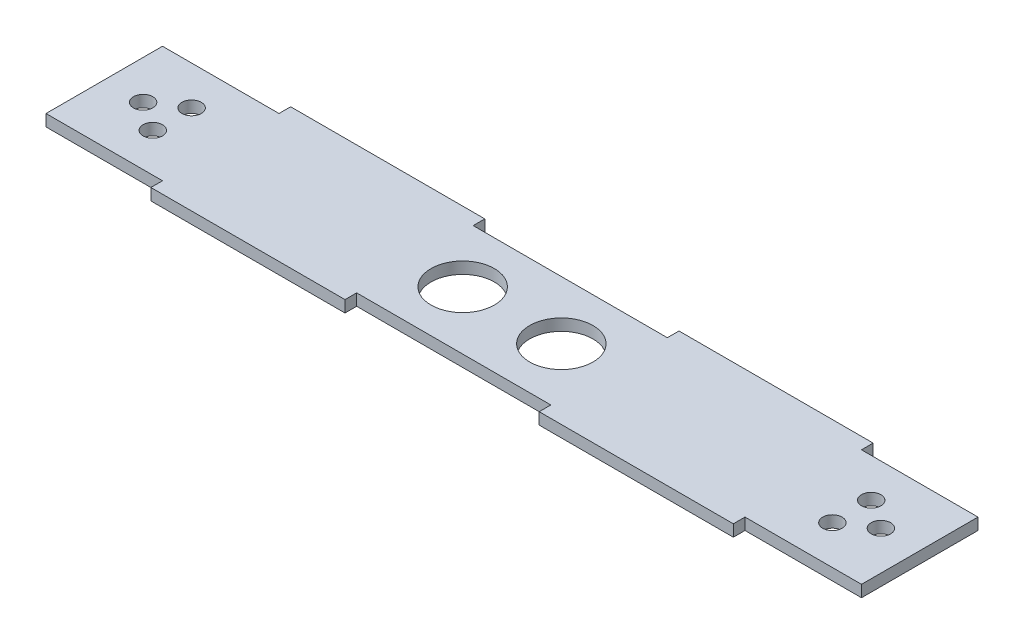
from build123d import *

# Parameters (mm, degrees)
SKETCH1_W           = 210
SKETCH1_H           = 30
BOSS_EXTRUDE1_DEPTH = 3
SKETCH2_W           = 50
SKETCH2_H           = 3
BOSS_EXTRUDE2_DEPTH = 3
SKETCH3_R           = 8.15
CUT_EXTRUDE1_DEPTH  = 10
SKETCH4_R           = 2.5
CUT_EXTRUDE2_DEPTH  = 10


with BuildPart() as part:
    # Sketch1 → Boss-Extrude1 (new body)
    with BuildSketch(Plane(origin=(0, 0, 0), x_dir=(1, 0, 0), z_dir=(0, 1, 0))):
        Rectangle(SKETCH1_W, SKETCH1_H)
    extrude(amount=BOSS_EXTRUDE1_DEPTH)

    # Sketch2 → Boss-Extrude2 (add)
    with BuildSketch(Plane(origin=(0, 0, 0), x_dir=(1, 0, 0), z_dir=(0, 1, 0))):
        with Locations((-50, 16.5)):
            Rectangle(SKETCH2_W, SKETCH2_H)
        with Locations((50, 16.5)):
            Rectangle(SKETCH2_W, SKETCH2_H)
        with Locations((50, -16.5)):
            Rectangle(SKETCH2_W, SKETCH2_H)
        with Locations((-50, -16.5)):
            Rectangle(SKETCH2_W, SKETCH2_H)
    extrude(amount=BOSS_EXTRUDE2_DEPTH)

    # Sketch3 → Cut-Extrude1 (cut)
    with BuildSketch(Plane(origin=(0, 3, 0), x_dir=(1, 0, 0), z_dir=(0, 1, 0))):
        with Locations(Location((-12.7, 0, 0), (0, 0, 270))):
            Circle(SKETCH3_R)
        with Locations(Location((12.7, 0, 0), (0, 0, 90))):
            Circle(SKETCH3_R)
    extrude(amount=-CUT_EXTRUDE1_DEPTH, mode=Mode.SUBTRACT)

    # Sketch4 → Cut-Extrude2 (cut)
    with BuildSketch(Plane(origin=(0, 3, 0), x_dir=(1, 0, 0), z_dir=(0, 1, 0))):
        with Locations(Location((-95, 0, 0), (0, 0, 270))):
            Circle(SKETCH4_R)
        with Locations(Location((-87.5, 5, 0), (0, 0, 270))):
            Circle(SKETCH4_R)
        with Locations(Location((-87.5, -5, 0), (0, 0, 270))):
            Circle(SKETCH4_R)
        with Locations(Location((87.5, -5, 0), (0, 0, 90))):
            Circle(SKETCH4_R)
        with Locations(Location((87.5, 5, 0), (0, 0, 90))):
            Circle(SKETCH4_R)
        with Locations(Location((95, 0, 0), (0, 0, 90))):
            Circle(SKETCH4_R)
    extrude(amount=-CUT_EXTRUDE2_DEPTH, mode=Mode.SUBTRACT)


solid = part.part
